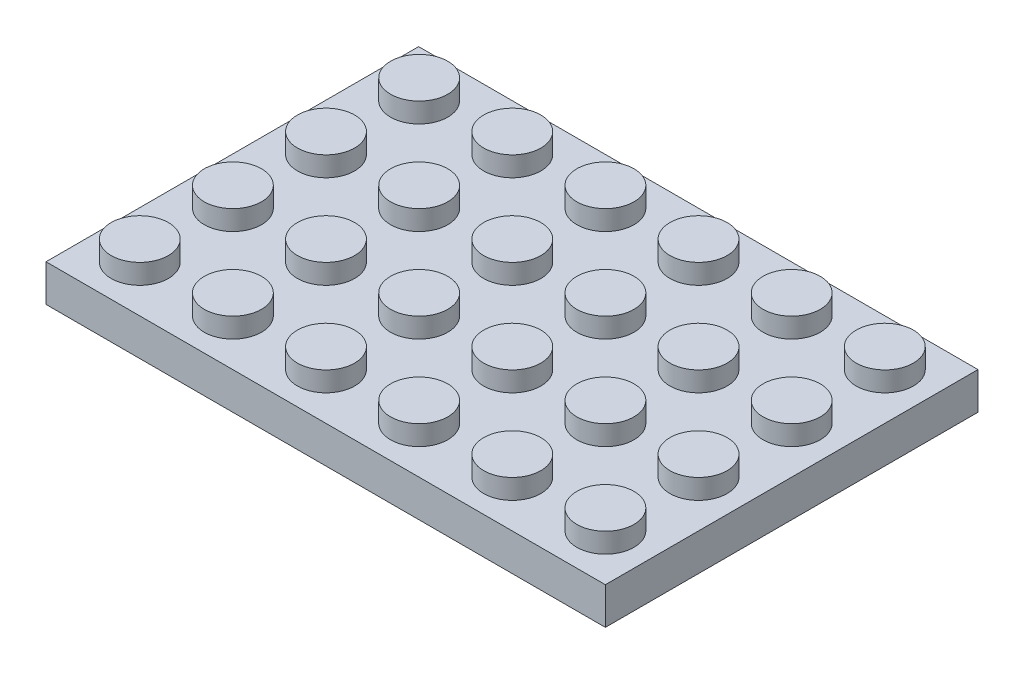
from build123d import *

# Parameters (mm, degrees)
SKETCH1_W           = 47.81
SKETCH1_H           = 31.85
BOSS_EXTRUDE1_DEPTH = 3.16
SKETCH2_R           = 2.445
BOSS_EXTRUDE2_DEPTH = 1.7
SHELL1_T            = -0.78
SKETCH3_R           = 2.35
SKETCH3_R_2         = 2.175
BOSS_EXTRUDE3_DEPTH = 2.18


with BuildPart() as part:
    # Sketch1 → Boss-Extrude1 (new body)
    with BuildSketch(Plane(origin=(0, 0, 0), x_dir=(1, 0, 0), z_dir=(0, 1, 0))):
        Rectangle(SKETCH1_W, SKETCH1_H)
    extrude(amount=-BOSS_EXTRUDE1_DEPTH)

    # Sketch2 → Boss-Extrude2 (add)
    with BuildSketch(Plane(origin=(0, 0, 0), x_dir=(1, 0, 0), z_dir=(0, 1, 0))):
        with Locations(Location((19.920833333, 11.94375, 0), (0, 0, 270))):
            Circle(SKETCH2_R)
        with Locations(Location((11.960833333, 11.94375, 0), (0, 0, 270))):
            Circle(SKETCH2_R)
        with Locations(Location((4.000833333, 11.94375, 0), (0, 0, 270))):
            Circle(SKETCH2_R)
        with Locations(Location((-3.959166667, 11.94375, 0), (0, 0, 270))):
            Circle(SKETCH2_R)
        with Locations(Location((-11.919166667, 11.94375, 0), (0, 0, 270))):
            Circle(SKETCH2_R)
        with Locations(Location((-19.879166667, 11.94375, 0), (0, 0, 270))):
            Circle(SKETCH2_R)
        with Locations(Location((11.960833333, 3.98375, 0), (0, 0, 270))):
            Circle(SKETCH2_R)
        with Locations(Location((4.000833333, 3.98375, 0), (0, 0, 270))):
            Circle(SKETCH2_R)
        with Locations(Location((-3.959166667, 3.98375, 0), (0, 0, 270))):
            Circle(SKETCH2_R)
        with Locations(Location((-11.919166667, 3.98375, 0), (0, 0, 270))):
            Circle(SKETCH2_R)
        with Locations(Location((-19.879166667, 3.98375, 0), (0, 0, 270))):
            Circle(SKETCH2_R)
        with Locations(Location((11.960833333, -3.97625, 0), (0, 0, 270))):
            Circle(SKETCH2_R)
        with Locations(Location((4.000833333, -3.97625, 0), (0, 0, 270))):
            Circle(SKETCH2_R)
        with Locations(Location((-3.959166667, -3.97625, 0), (0, 0, 270))):
            Circle(SKETCH2_R)
        with Locations(Location((-11.919166667, -3.97625, 0), (0, 0, 270))):
            Circle(SKETCH2_R)
        with Locations(Location((-19.879166667, -3.97625, 0), (0, 0, 270))):
            Circle(SKETCH2_R)
        with Locations(Location((11.960833333, -11.93625, 0), (0, 0, 270))):
            Circle(SKETCH2_R)
        with Locations(Location((4.000833333, -11.93625, 0), (0, 0, 270))):
            Circle(SKETCH2_R)
        with Locations(Location((-3.959166667, -11.93625, 0), (0, 0, 270))):
            Circle(SKETCH2_R)
        with Locations(Location((-11.919166667, -11.93625, 0), (0, 0, 270))):
            Circle(SKETCH2_R)
        with Locations(Location((-19.879166667, -11.93625, 0), (0, 0, 270))):
            Circle(SKETCH2_R)
        with Locations(Location((19.920833333, 3.98375, 0), (0, 0, 270))):
            Circle(SKETCH2_R)
        with Locations(Location((19.920833333, -3.97625, 0), (0, 0, 270))):
            Circle(SKETCH2_R)
        with Locations(Location((19.920833333, -11.93625, 0), (0, 0, 270))):
            Circle(SKETCH2_R)
    extrude(amount=BOSS_EXTRUDE2_DEPTH)

    # Shell1
    shell1_openings = [part.faces().sort_by_distance(p)[0] for p in [
        (0, -3.16, 0),
    ]]
    offset(amount=SHELL1_T, openings=shell1_openings, kind=Kind.INTERSECTION)

    # Sketch3 → Boss-Extrude3 (add)
    # profile 1 of 15: a face of its own
    with BuildSketch(Plane.XZ.offset(0.78)):
        with Locations(Location((-15.936666667, 7.9625, 0), (0, 0, 90))):
            Circle(SKETCH3_R)
        with Locations(Location((-15.936666667, 7.9625, 0), (0, 0, 90))):
            Circle(SKETCH3_R_2, mode=Mode.SUBTRACT)
    # profile 2 of 15: a face of its own
    with BuildSketch(Plane.XZ.offset(0.78)):
        with Locations(Location((-7.966666667, 7.9625, 0), (0, 0, 90))):
            Circle(SKETCH3_R)
        with Locations(Location((-7.966666667, 7.9625, 0), (0, 0, 90))):
            Circle(SKETCH3_R_2, mode=Mode.SUBTRACT)
    # profile 3 of 15: a face of its own
    with BuildSketch(Plane.XZ.offset(0.78)):
        with Locations(Location((0.003333333, 7.9625, 0), (0, 0, 90))):
            Circle(SKETCH3_R)
        with Locations(Location((0.003333333, 7.9625, 0), (0, 0, 90))):
            Circle(SKETCH3_R_2, mode=Mode.SUBTRACT)
    # profile 4 of 15: a face of its own
    with BuildSketch(Plane.XZ.offset(0.78)):
        with Locations(Location((7.973333333, 7.9625, 0), (0, 0, 90))):
            Circle(SKETCH3_R)
        with Locations(Location((7.973333333, 7.9625, 0), (0, 0, 90))):
            Circle(SKETCH3_R_2, mode=Mode.SUBTRACT)
    # profile 5 of 15: a face of its own
    with BuildSketch(Plane.XZ.offset(0.78)):
        with Locations(Location((15.943333333, 7.9625, 0), (0, 0, 90))):
            Circle(SKETCH3_R)
        with Locations(Location((15.943333333, 7.9625, 0), (0, 0, 90))):
            Circle(SKETCH3_R_2, mode=Mode.SUBTRACT)
    # profile 6 of 15: a face of its own
    with BuildSketch(Plane.XZ.offset(0.78)):
        with Locations(Location((-7.966666667, 0.0025, 0), (0, 0, 90))):
            Circle(SKETCH3_R)
        with Locations(Location((-7.966666667, 0.0025, 0), (0, 0, 90))):
            Circle(SKETCH3_R_2, mode=Mode.SUBTRACT)
    # profile 7 of 15: a face of its own
    with BuildSketch(Plane.XZ.offset(0.78)):
        with Locations(Location((0.003333333, 0.0025, 0), (0, 0, 90))):
            Circle(SKETCH3_R)
        with Locations(Location((0.003333333, 0.0025, 0), (0, 0, 90))):
            Circle(SKETCH3_R_2, mode=Mode.SUBTRACT)
    # profile 8 of 15: a face of its own
    with BuildSketch(Plane.XZ.offset(0.78)):
        with Locations(Location((7.973333333, 0.0025, 0), (0, 0, 90))):
            Circle(SKETCH3_R)
        with Locations(Location((7.973333333, 0.0025, 0), (0, 0, 90))):
            Circle(SKETCH3_R_2, mode=Mode.SUBTRACT)
    # profile 9 of 15: a face of its own
    with BuildSketch(Plane.XZ.offset(0.78)):
        with Locations(Location((15.943333333, 0.0025, 0), (0, 0, 90))):
            Circle(SKETCH3_R)
        with Locations(Location((15.943333333, 0.0025, 0), (0, 0, 90))):
            Circle(SKETCH3_R_2, mode=Mode.SUBTRACT)
    # profile 10 of 15: a face of its own
    with BuildSketch(Plane.XZ.offset(0.78)):
        with Locations(Location((-7.966666667, -7.9575, 0), (0, 0, 90))):
            Circle(SKETCH3_R)
        with Locations(Location((-7.966666667, -7.9575, 0), (0, 0, 90))):
            Circle(SKETCH3_R_2, mode=Mode.SUBTRACT)
    # profile 11 of 15: a face of its own
    with BuildSketch(Plane.XZ.offset(0.78)):
        with Locations(Location((0.003333333, -7.9575, 0), (0, 0, 90))):
            Circle(SKETCH3_R)
        with Locations(Location((0.003333333, -7.9575, 0), (0, 0, 90))):
            Circle(SKETCH3_R_2, mode=Mode.SUBTRACT)
    # profile 12 of 15: a face of its own
    with BuildSketch(Plane.XZ.offset(0.78)):
        with Locations(Location((7.973333333, -7.9575, 0), (0, 0, 90))):
            Circle(SKETCH3_R)
        with Locations(Location((7.973333333, -7.9575, 0), (0, 0, 90))):
            Circle(SKETCH3_R_2, mode=Mode.SUBTRACT)
    # profile 13 of 15: a face of its own
    with BuildSketch(Plane.XZ.offset(0.78)):
        with Locations(Location((15.943333333, -7.9575, 0), (0, 0, 90))):
            Circle(SKETCH3_R)
        with Locations(Location((15.943333333, -7.9575, 0), (0, 0, 90))):
            Circle(SKETCH3_R_2, mode=Mode.SUBTRACT)
    # profile 14 of 15: a face of its own
    with BuildSketch(Plane.XZ.offset(0.78)):
        with Locations(Location((-15.936666667, 0.0025, 0), (0, 0, 90))):
            Circle(SKETCH3_R)
        with Locations(Location((-15.936666667, 0.0025, 0), (0, 0, 90))):
            Circle(SKETCH3_R_2, mode=Mode.SUBTRACT)
    # profile 15 of 15: a face of its own
    with BuildSketch(Plane.XZ.offset(0.78)):
        with Locations(Location((-15.936666667, -7.9575, 0), (0, 0, 90))):
            Circle(SKETCH3_R)
        with Locations(Location((-15.936666667, -7.9575, 0), (0, 0, 90))):
            Circle(SKETCH3_R_2, mode=Mode.SUBTRACT)
    extrude(amount=BOSS_EXTRUDE3_DEPTH)


solid = part.part
